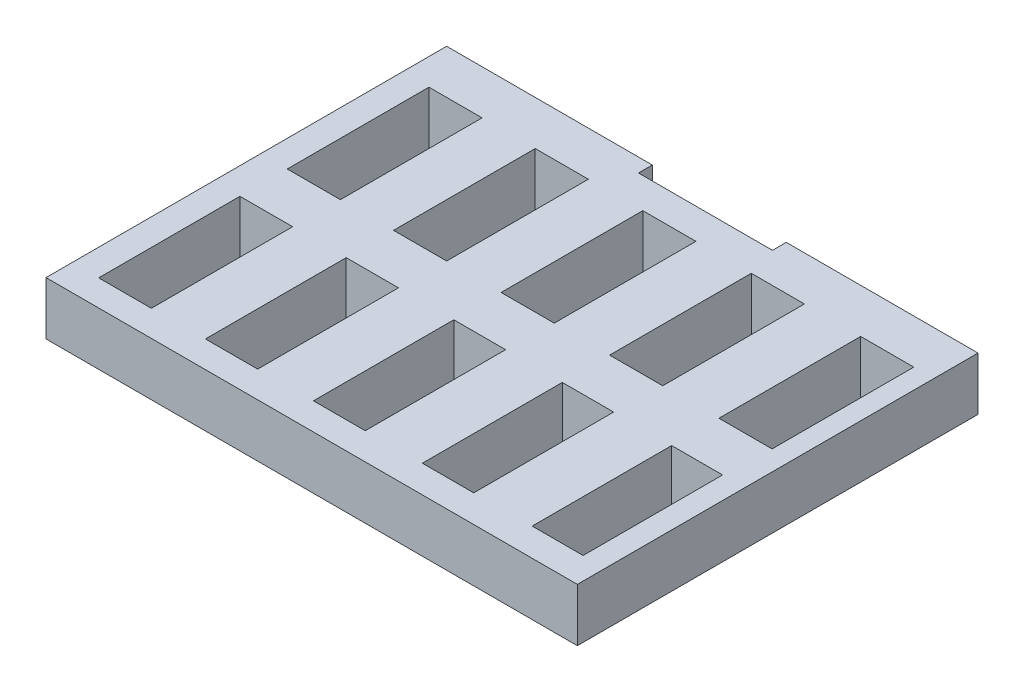
from build123d import *

# Parameters (mm, degrees)
SKETCH1_W           = 60
SKETCH1_H           = 60
BOSS_EXTRUDE1_DEPTH = 6
SKETCH2_W           = 6
SKETCH2_H           = 16
SKETCH2_W_2         = 5.95
SKETCH2_H_2         = 15.95
SKETCH2_W_3         = 5.9
SKETCH2_H_3         = 15.9
SKETCH2_W_4         = 5.85
SKETCH2_H_4         = 15.85
SKETCH2_W_5         = 5.8
SKETCH2_H_5         = 15.8
SKETCH2_W_6         = 5.75
SKETCH2_H_6         = 15.75
CUT_EXTRUDE1_DEPTH  = 6
SKETCH3_W           = 15.128686335
SKETCH3_H           = 1.558081165
CUT_EXTRUDE2_DEPTH  = 6
SKETCH4_W           = 60
SKETCH4_H           = 14.757524832
CUT_EXTRUDE3_DEPTH  = 6


with BuildPart() as part:
    # Sketch1 → Boss-Extrude1 (new body)
    with BuildSketch(Plane(origin=(0, 0, 0), x_dir=(1, 0, 0), z_dir=(0, 1, 0))):
        with Locations((30, 30)):
            Rectangle(SKETCH1_W, SKETCH1_H)
    extrude(amount=BOSS_EXTRUDE1_DEPTH)

    # Sketch2 → Cut-Extrude1 (cut)
    with BuildSketch(Plane(origin=(0, 6, 0), x_dir=(1, 0, 0), z_dir=(0, 1, 0))):
        with Locations((6, 47)):
            Rectangle(SKETCH2_W, SKETCH2_H)
        with Locations((18, 47)):
            Rectangle(SKETCH2_W, SKETCH2_H)
        with Locations((30.15, 47)):
            Rectangle(SKETCH2_W, SKETCH2_H)
        with Locations((42.4, 47)):
            Rectangle(SKETCH2_W, SKETCH2_H)
        with Locations((54.75, 47)):
            Rectangle(SKETCH2_W, SKETCH2_H)
        with Locations((5.975, 25.682524832)):
            Rectangle(SKETCH2_W_2, SKETCH2_H_2)
        with Locations((17.95, 25.707524832)):
            Rectangle(SKETCH2_W_3, SKETCH2_H_3)
        with Locations((30.075, 25.732524832)):
            Rectangle(SKETCH2_W_4, SKETCH2_H_4)
        with Locations((42.3, 25.757524832)):
            Rectangle(SKETCH2_W_5, SKETCH2_H_5)
        with Locations((54.625, 25.782524832)):
            Rectangle(SKETCH2_W_6, SKETCH2_H_6)
    extrude(amount=-CUT_EXTRUDE1_DEPTH, mode=Mode.SUBTRACT)

    # Sketch3 → Cut-Extrude2 (cut)
    with BuildSketch(Plane(origin=(0, 6, 0), x_dir=(1, 0, 0), z_dir=(0, 1, 0))):
        with Locations((30.785905784, 59.220959418)):
            Rectangle(SKETCH3_W, SKETCH3_H)
    extrude(amount=-CUT_EXTRUDE2_DEPTH, mode=Mode.SUBTRACT)

    # Sketch4 → Cut-Extrude3 (cut)
    with BuildSketch(Plane(origin=(0, 6, 0), x_dir=(1, 0, 0), z_dir=(0, 1, 0))):
        with Locations((30, 7.378762416)):
            Rectangle(SKETCH4_W, SKETCH4_H)
    extrude(amount=-CUT_EXTRUDE3_DEPTH, mode=Mode.SUBTRACT)


solid = part.part
